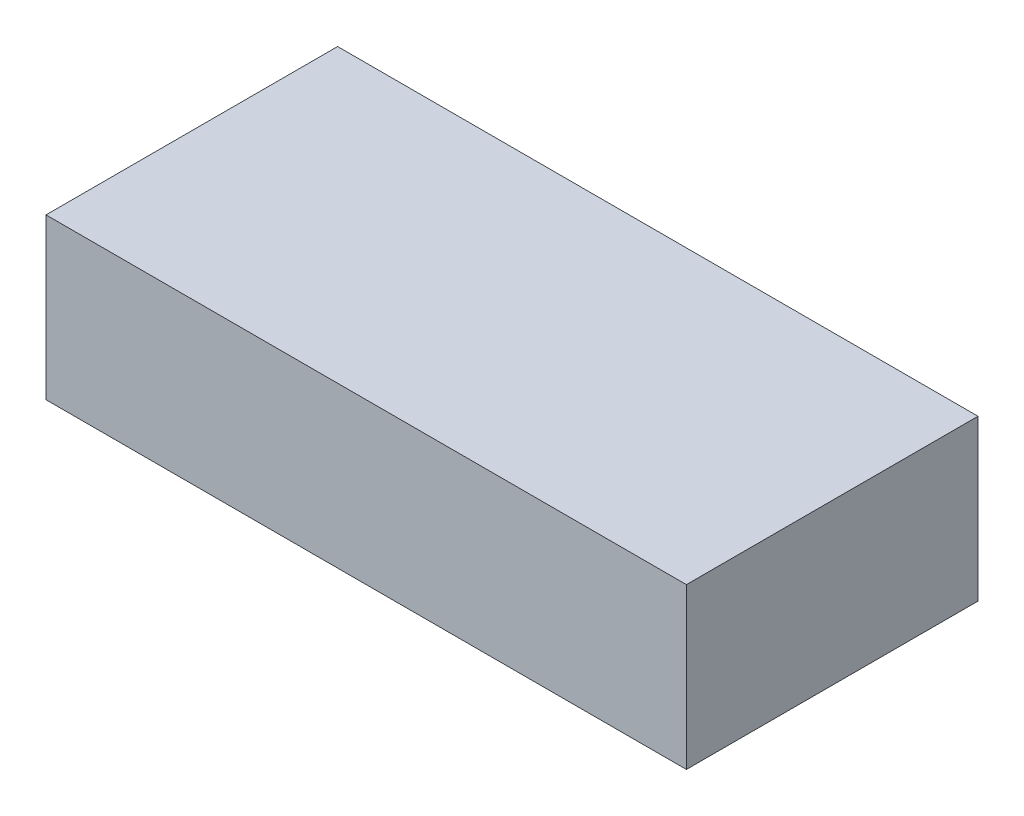
from build123d import *

# Parameters (mm, degrees)
SKETCH1_W           = 56
SKETCH1_H           = 25.5
BOSS_EXTRUDE1_DEPTH = 14


with BuildPart() as part:
    # Sketch1 → Boss-Extrude1 (new body)
    with BuildSketch(Plane(origin=(0, 0, 0), x_dir=(1, 0, 0), z_dir=(0, 1, 0))):
        Rectangle(SKETCH1_W, SKETCH1_H)
    extrude(amount=BOSS_EXTRUDE1_DEPTH)


solid = part.part
